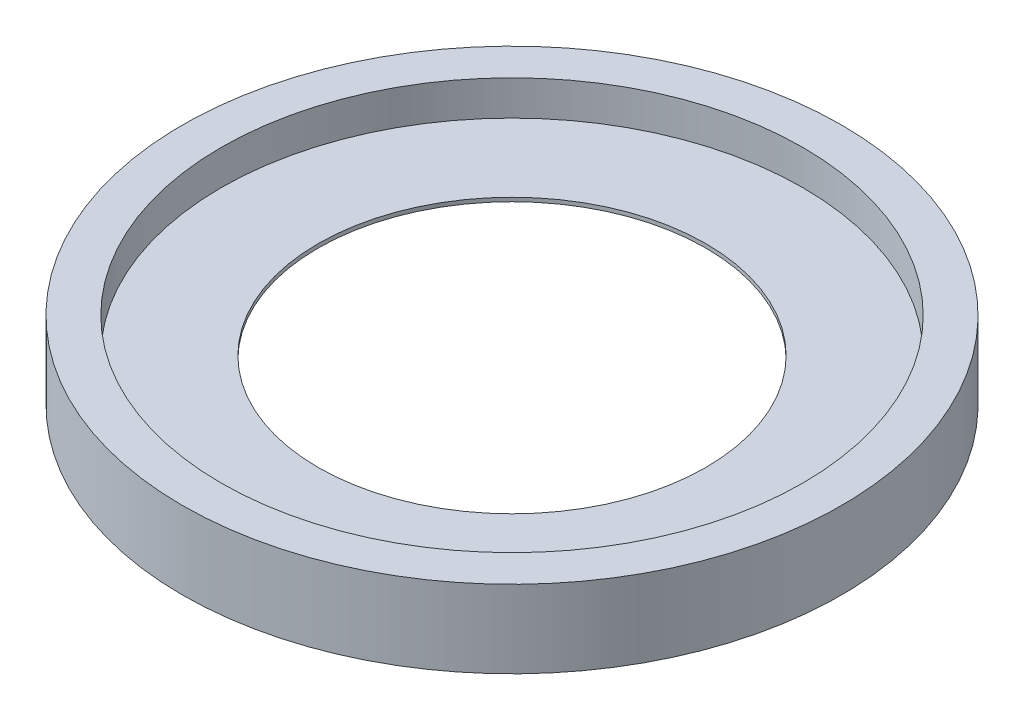
from build123d import *

# Parameters (mm, degrees)
SKETCH1_R           = 8.5
SKETCH1_R_2         = 7.5
BOSS_EXTRUDE1_DEPTH = 2
BOSS_EXTRUDE2_START = -1
SKETCH2_R           = 7.5
SKETCH2_R_2         = 5
BOSS_EXTRUDE2_DEPTH = 0.1


with BuildPart() as part:
    # Sketch1 → Boss-Extrude1 (new body)
    with BuildSketch(Plane(origin=(0, 0, 0), x_dir=(1, 0, 0), z_dir=(0, 1, 0))):
        with Locations(Location((0, 0, 0), (0, 0, 270))):
            Circle(SKETCH1_R)
        with Locations(Location((0, 0, 0), (0, 0, 270))):
            Circle(SKETCH1_R_2, mode=Mode.SUBTRACT)
    extrude(amount=BOSS_EXTRUDE1_DEPTH)

    # Sketch2 → Boss-Extrude2 (add)
    with BuildSketch(Plane(origin=(0, 2, 0), x_dir=(1, 0, 0), z_dir=(0, 1, 0)).offset(BOSS_EXTRUDE2_START)):
        with Locations(Location((0, 0, 0), (0, 0, 270))):
            Circle(SKETCH2_R)
        with Locations(Location((0, 0, 0), (0, 0, 270))):
            Circle(SKETCH2_R_2, mode=Mode.SUBTRACT)
    extrude(amount=BOSS_EXTRUDE2_DEPTH)


solid = part.part
